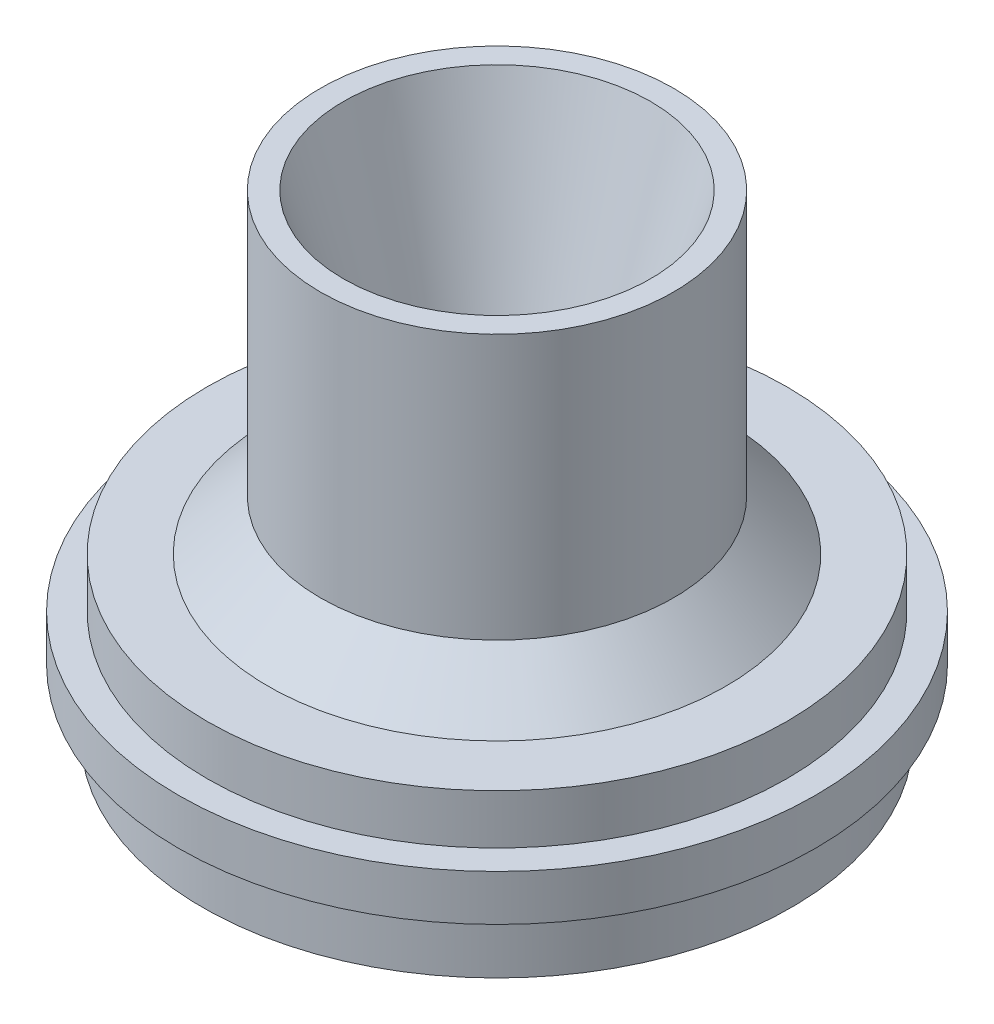
from build123d import *


with BuildPart() as part:
    # Sketch1 → Revolve1 (revolve)
    with BuildSketch(Plane.XY, mode=Mode.PRIVATE) as revolve1_sk:
        Polygon((-22.098, 25.4), (-12.2555, -7.366), (-12.2555, -30.226), (-35.0647, -42.8244), (-42.318558906, -42.8244), (-42.318558906, -33.6804), (-45.8216, -33.6804), (-45.8216, -27.0764), (-41.6941, -27.0764), (-41.6941, -19.939), (-32.9311, -19.939), (-25.4, -12.7), (-25.4, 25.4), align=None)
    revolve(revolve1_sk.sketch.rotate(Axis((0, 0, 0), (0, 1, 0)), 270), axis=Axis((0, 0, 0), (0, 1, 0)))


solid = part.part
